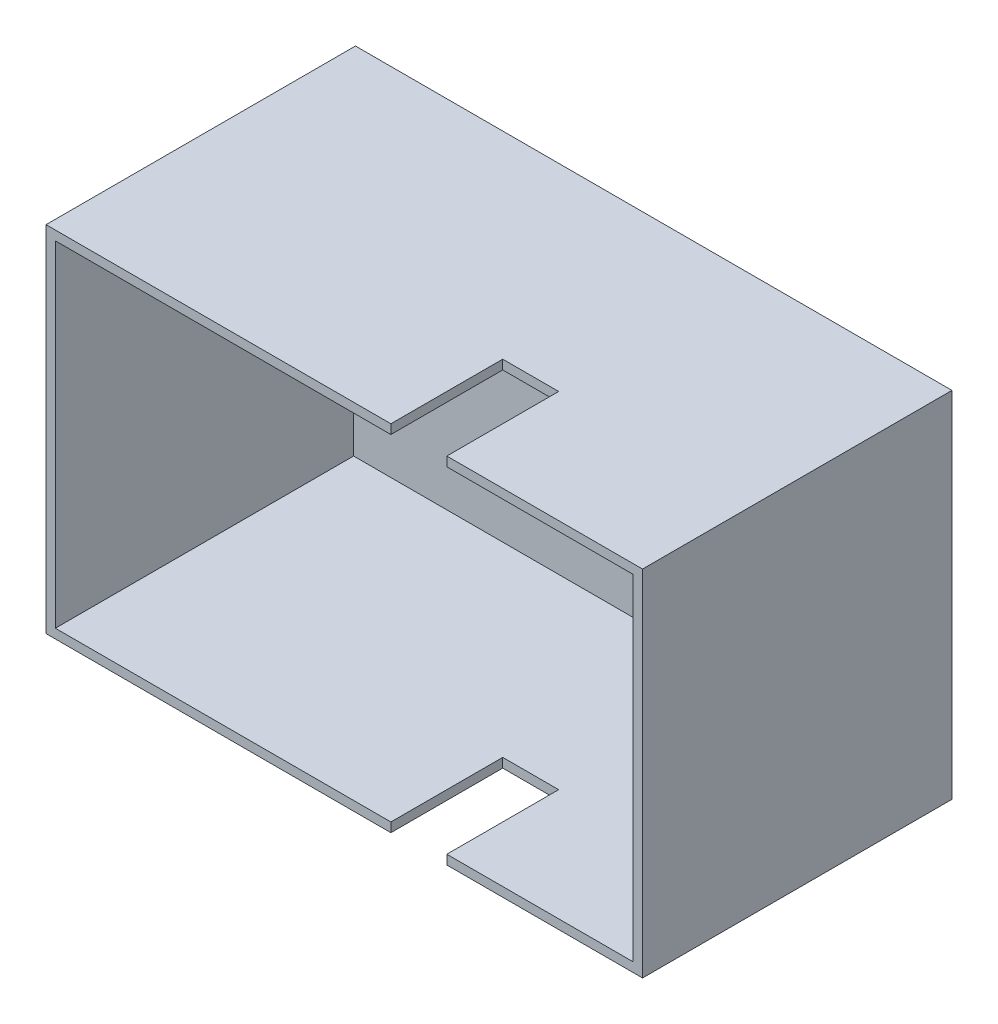
from build123d import *

# Parameters (mm, degrees)
SKETCH_1_W          = 160
SKETCH_1_H          = 95
SKETCH_1_W_2        = 155
SKETCH_1_H_2        = 90
EXTRUDE_1_DEPTH     = 80
SKETCH_3_W          = 160
SKETCH_3_H          = 95
EXTRUDE_2_DEPTH     = 3
SKETCH_4_R          = 4
CUT_EXTRUDE_1_DEPTH = 10
SKETCH_5_W          = 15
SKETCH_5_H          = 30
CUT_EXTRUDE_2_DEPTH = 148.732867027


with BuildPart() as part:
    # ｽｹｯﾁ1 → ﾎﾞｽ - 押し出し1 (new body)
    with BuildSketch(Plane.XY):
        Rectangle(SKETCH_1_W, SKETCH_1_H)
        Rectangle(SKETCH_1_W_2, SKETCH_1_H_2, mode=Mode.SUBTRACT)
    extrude(amount=EXTRUDE_1_DEPTH)

    # ｽｹｯﾁ3 → ﾎﾞｽ - 押し出し2 (add)
    with BuildSketch(Plane(origin=(0, 0, 0), x_dir=(-1, 0, 0), z_dir=(0, 0, -1))):
        Rectangle(SKETCH_3_W, SKETCH_3_H)
    extrude(amount=EXTRUDE_2_DEPTH)

    # ｽｹｯﾁ4 → ｶｯﾄ - 押し出し1 (cut)
    with BuildSketch(Plane.XY):
        Circle(SKETCH_4_R)
        with Locations((-56, 0)):
            Circle(SKETCH_4_R)
        with Locations((56, 0)):
            Circle(SKETCH_4_R)
    extrude(amount=-CUT_EXTRUDE_1_DEPTH, mode=Mode.SUBTRACT)

    # ｽｹｯﾁ5 → ｶｯﾄ - 押し出し2 (cut, through all)
    with BuildSketch(Plane.XZ.offset(47.5)):
        with Locations((20, 65)):
            Rectangle(SKETCH_5_W, SKETCH_5_H)
    extrude(amount=-CUT_EXTRUDE_2_DEPTH, mode=Mode.SUBTRACT)


solid = part.part
